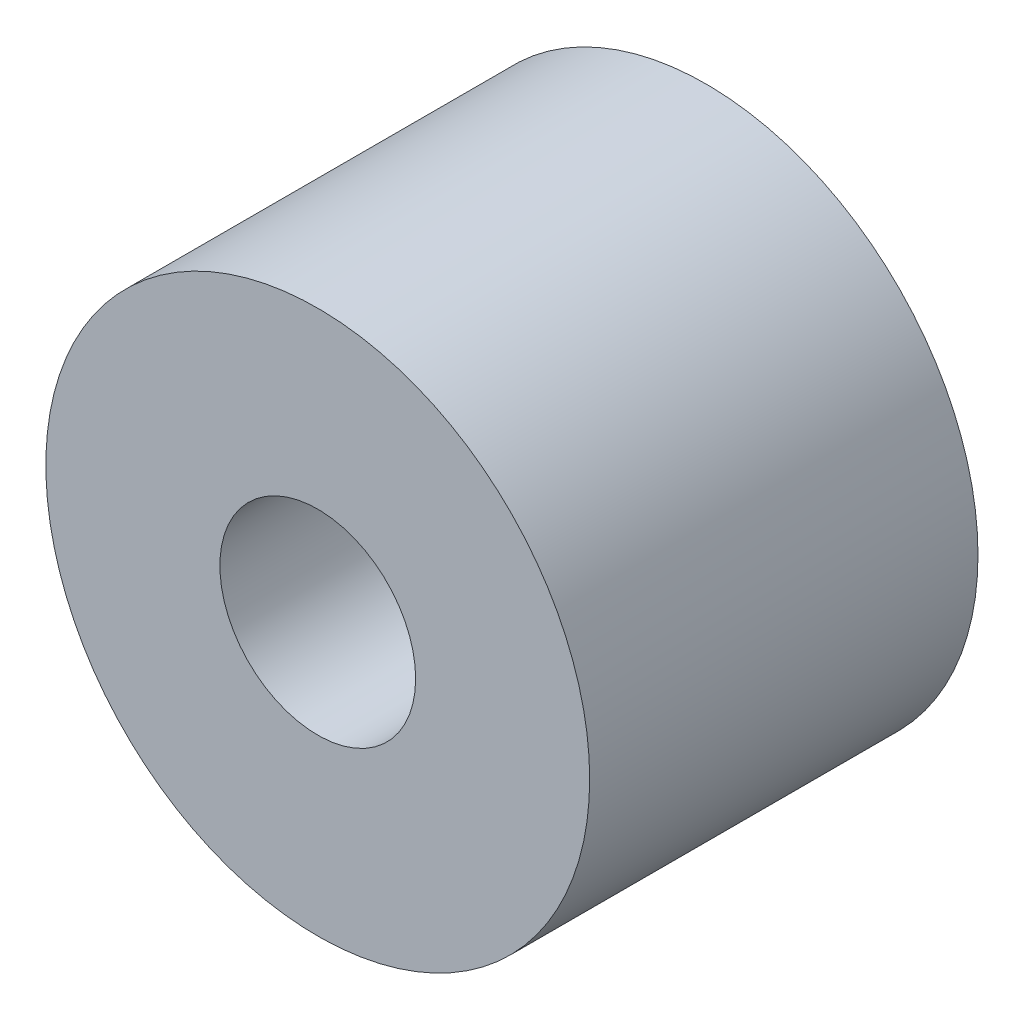
from build123d import *

# Parameters (mm, degrees)
SKETCH1_R           = 6.35
SKETCH1_R_2         = 2.286
BOSS_EXTRUDE1_DEPTH = 9.0678


with BuildPart() as part:
    # Sketch1 → Boss-Extrude1 (new body)
    with BuildSketch(Plane.XY):
        Circle(SKETCH1_R)
        Circle(SKETCH1_R_2, mode=Mode.SUBTRACT)
    extrude(amount=BOSS_EXTRUDE1_DEPTH)


solid = part.part
